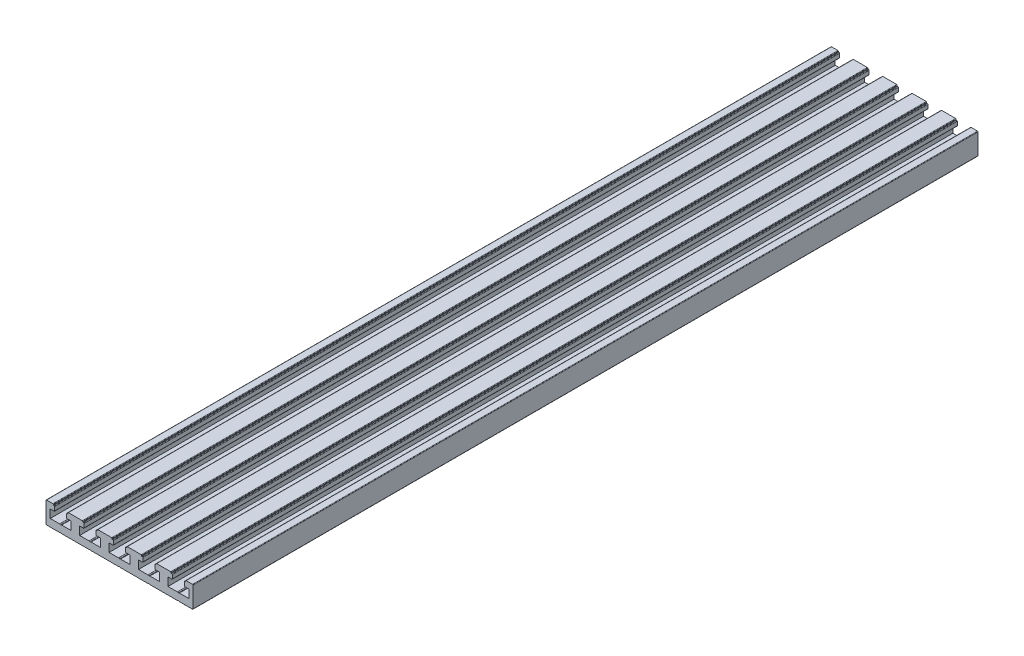
from build123d import *

# Parameters (mm, degrees)
RAWPART_DEPTH                                   = 400
CSK_FOR_M3_FLAT_HEAD_MACHINE_SCREW1_D           = 3.2
CSK_FOR_M3_FLAT_HEAD_MACHINE_SCREW1_CSINK_D     = 6
CSK_FOR_M3_FLAT_HEAD_MACHINE_SCREW1_CSINK_ANGLE = 90
M4X0_7_TAPPED_HOLE1_D                           = 3.3


with BuildPart() as part:
    # Sketch1 → RawPart (new body)
    with BuildSketch(Plane(origin=(0, 0, 0), x_dir=(-1, 0, 0), z_dir=(0, 0, -1))):
        with BuildLine():
            Line((-37.45, 8.85), (-37.45, -1.65))
            ThreePointArc((-37.45, -1.65), (-37.376776695, -1.826776695), (-37.2, -1.9))
            Line((-37.2, -1.9), (-30.543629459, -1.9))
            ThreePointArc((-30.543629459, -1.9), (-30.500649598, -1.896277753), (-30.458949592, -1.885221853))
            Line((-30.458949592, -1.885221853), (-30, -1.72))
            Line((-30, -1.72), (-29.541050408, -1.885221853))
            ThreePointArc((-29.541050408, -1.885221853), (-29.499350402, -1.896277753), (-29.456370541, -1.9))
            Line((-29.456370541, -1.9), (-15.543629459, -1.9))
            ThreePointArc((-15.543629459, -1.9), (-15.500649598, -1.896277753), (-15.458949592, -1.885221853))
            Line((-15.458949592, -1.885221853), (-15, -1.72))
            Line((-15, -1.72), (-14.541050408, -1.885221853))
            ThreePointArc((-14.541050408, -1.885221853), (-14.499350402, -1.896277753), (-14.456370541, -1.9))
            Line((-14.456370541, -1.9), (-0.543629459, -1.9))
            ThreePointArc((-0.543629459, -1.9), (-0.500649598, -1.896277753), (-0.458949592, -1.885221853))
            Line((-0.458949592, -1.885221853), (0, -1.72))
            Line((0, -1.72), (0.458949592, -1.885221853))
            ThreePointArc((0.458949592, -1.885221853), (0.500649598, -1.896277753), (0.543629459, -1.9))
            Line((0.543629459, -1.9), (14.456370541, -1.9))
            ThreePointArc((14.456370541, -1.9), (14.499350402, -1.896277753), (14.541050408, -1.885221853))
            Line((14.541050408, -1.885221853), (15, -1.72))
            Line((15, -1.72), (15.458949592, -1.885221853))
            ThreePointArc((15.458949592, -1.885221853), (15.500649598, -1.896277753), (15.543629459, -1.9))
            Line((15.543629459, -1.9), (29.456370541, -1.9))
            ThreePointArc((29.456370541, -1.9), (29.499350402, -1.896277753), (29.541050408, -1.885221853))
            Line((29.541050408, -1.885221853), (30, -1.72))
            Line((30, -1.72), (30.458949592, -1.885221853))
            ThreePointArc((30.458949592, -1.885221853), (30.500649598, -1.896277753), (30.543629459, -1.9))
            Line((30.543629459, -1.9), (37.2, -1.9))
            ThreePointArc((37.2, -1.9), (37.376776695, -1.826776695), (37.45, -1.65))
            Line((37.45, -1.65), (37.45, 8.85))
            ThreePointArc((37.45, 8.85), (37.376776695, 9.026776695), (37.2, 9.1))
            Line((37.2, 9.1), (33.95, 9.1))
            ThreePointArc((33.95, 9.1), (33.773223305, 9.026776695), (33.7, 8.85))
            Line((33.7, 8.85), (33.7, 8.5))
            Line((33.7, 8.5), (33.32, 8.5))
            ThreePointArc((33.32, 8.5), (33.143223305, 8.426776695), (33.07, 8.25))
            Line((33.07, 8.25), (33.07, 6.35))
            ThreePointArc((33.07, 6.35), (33.143223305, 6.173223305), (33.32, 6.1))
            Line((33.32, 6.1), (35.3, 6.1))
            Line((35.3, 6.1), (35.3, 1.9))
            Line((35.3, 1.9), (30.543629459, 1.9))
            ThreePointArc((30.543629459, 1.9), (30.500649598, 1.896277753), (30.458949592, 1.885221853))
            Line((30.458949592, 1.885221853), (30, 1.72))
            Line((30, 1.72), (29.541050408, 1.885221853))
            ThreePointArc((29.541050408, 1.885221853), (29.499350402, 1.896277753), (29.456370541, 1.9))
            Line((29.456370541, 1.9), (24.7, 1.9))
            Line((24.7, 1.9), (24.7, 6.1))
            Line((24.7, 6.1), (26.68, 6.1))
            ThreePointArc((26.68, 6.1), (26.856776695, 6.173223305), (26.93, 6.35))
            Line((26.93, 6.35), (26.93, 8.25))
            ThreePointArc((26.93, 8.25), (26.856776695, 8.426776695), (26.68, 8.5))
            Line((26.68, 8.5), (26.3, 8.5))
            Line((26.3, 8.5), (26.3, 8.85))
            ThreePointArc((26.3, 8.85), (26.226776695, 9.026776695), (26.05, 9.1))
            Line((26.05, 9.1), (18.95, 9.1))
            ThreePointArc((18.95, 9.1), (18.773223305, 9.026776695), (18.7, 8.85))
            Line((18.7, 8.85), (18.7, 8.5))
            Line((18.7, 8.5), (18.32, 8.5))
            ThreePointArc((18.32, 8.5), (18.143223305, 8.426776695), (18.07, 8.25))
            Line((18.07, 8.25), (18.07, 6.35))
            ThreePointArc((18.07, 6.35), (18.143223305, 6.173223305), (18.32, 6.1))
            Line((18.32, 6.1), (20.3, 6.1))
            Line((20.3, 6.1), (20.3, 1.9))
            Line((20.3, 1.9), (15.543629459, 1.9))
            ThreePointArc((15.543629459, 1.9), (15.500649598, 1.896277753), (15.458949592, 1.885221853))
            Line((15.458949592, 1.885221853), (15, 1.72))
            Line((15, 1.72), (14.541050408, 1.885221853))
            ThreePointArc((14.541050408, 1.885221853), (14.499350402, 1.896277753), (14.456370541, 1.9))
            Line((14.456370541, 1.9), (9.7, 1.9))
            Line((9.7, 1.9), (9.7, 6.1))
            Line((9.7, 6.1), (11.68, 6.1))
            ThreePointArc((11.68, 6.1), (11.856776695, 6.173223305), (11.93, 6.35))
            Line((11.93, 6.35), (11.93, 8.25))
            ThreePointArc((11.93, 8.25), (11.856776695, 8.426776695), (11.68, 8.5))
            Line((11.68, 8.5), (11.3, 8.5))
            Line((11.3, 8.5), (11.3, 8.85))
            ThreePointArc((11.3, 8.85), (11.226776695, 9.026776695), (11.05, 9.1))
            Line((11.05, 9.1), (3.95, 9.1))
            ThreePointArc((3.95, 9.1), (3.773223305, 9.026776695), (3.7, 8.85))
            Line((3.7, 8.85), (3.7, 8.5))
            Line((3.7, 8.5), (3.32, 8.5))
            ThreePointArc((3.32, 8.5), (3.143223305, 8.426776695), (3.07, 8.25))
            Line((3.07, 8.25), (3.07, 6.35))
            ThreePointArc((3.07, 6.35), (3.143223305, 6.173223305), (3.32, 6.1))
            Line((3.32, 6.1), (5.3, 6.1))
            Line((5.3, 6.1), (5.3, 1.9))
            Line((5.3, 1.9), (0.543629459, 1.9))
            ThreePointArc((0.543629459, 1.9), (0.500649598, 1.896277753), (0.458949592, 1.885221853))
            Line((0.458949592, 1.885221853), (0, 1.72))
            Line((0, 1.72), (-0.458949592, 1.885221853))
            ThreePointArc((-0.458949592, 1.885221853), (-0.500649598, 1.896277753), (-0.543629459, 1.9))
            Line((-0.543629459, 1.9), (-5.3, 1.9))
            Line((-5.3, 1.9), (-5.3, 6.1))
            Line((-5.3, 6.1), (-3.32, 6.1))
            ThreePointArc((-3.32, 6.1), (-3.143223305, 6.173223305), (-3.07, 6.35))
            Line((-3.07, 6.35), (-3.07, 8.25))
            ThreePointArc((-3.07, 8.25), (-3.143223305, 8.426776695), (-3.32, 8.5))
            Line((-3.32, 8.5), (-3.7, 8.5))
            Line((-3.7, 8.5), (-3.7, 8.85))
            ThreePointArc((-3.7, 8.85), (-3.773223305, 9.026776695), (-3.95, 9.1))
            Line((-3.95, 9.1), (-11.05, 9.1))
            ThreePointArc((-11.05, 9.1), (-11.226776695, 9.026776695), (-11.3, 8.85))
            Line((-11.3, 8.85), (-11.3, 8.5))
            Line((-11.3, 8.5), (-11.68, 8.5))
            ThreePointArc((-11.68, 8.5), (-11.856776695, 8.426776695), (-11.93, 8.25))
            Line((-11.93, 8.25), (-11.93, 6.35))
            ThreePointArc((-11.93, 6.35), (-11.856776695, 6.173223305), (-11.68, 6.1))
            Line((-11.68, 6.1), (-9.7, 6.1))
            Line((-9.7, 6.1), (-9.7, 1.9))
            Line((-9.7, 1.9), (-14.456370541, 1.9))
            ThreePointArc((-14.456370541, 1.9), (-14.499350402, 1.896277753), (-14.541050408, 1.885221853))
            Line((-14.541050408, 1.885221853), (-15, 1.72))
            Line((-15, 1.72), (-15.458949592, 1.885221853))
            ThreePointArc((-15.458949592, 1.885221853), (-15.500649598, 1.896277753), (-15.543629459, 1.9))
            Line((-15.543629459, 1.9), (-20.3, 1.9))
            Line((-20.3, 1.9), (-20.3, 6.1))
            Line((-20.3, 6.1), (-18.32, 6.1))
            ThreePointArc((-18.32, 6.1), (-18.143223305, 6.173223305), (-18.07, 6.35))
            Line((-18.07, 6.35), (-18.07, 8.25))
            ThreePointArc((-18.07, 8.25), (-18.143223305, 8.426776695), (-18.32, 8.5))
            Line((-18.32, 8.5), (-18.7, 8.5))
            Line((-18.7, 8.5), (-18.7, 8.85))
            ThreePointArc((-18.7, 8.85), (-18.773223305, 9.026776695), (-18.95, 9.1))
            Line((-18.95, 9.1), (-26.05, 9.1))
            ThreePointArc((-26.05, 9.1), (-26.226776695, 9.026776695), (-26.3, 8.85))
            Line((-26.3, 8.85), (-26.3, 8.5))
            Line((-26.3, 8.5), (-26.68, 8.5))
            ThreePointArc((-26.68, 8.5), (-26.856776695, 8.426776695), (-26.93, 8.25))
            Line((-26.93, 8.25), (-26.93, 6.35))
            ThreePointArc((-26.93, 6.35), (-26.856776695, 6.173223305), (-26.68, 6.1))
            Line((-26.68, 6.1), (-24.7, 6.1))
            Line((-24.7, 6.1), (-24.7, 1.9))
            Line((-24.7, 1.9), (-29.456370541, 1.9))
            ThreePointArc((-29.456370541, 1.9), (-29.499350402, 1.896277753), (-29.541050408, 1.885221853))
            Line((-29.541050408, 1.885221853), (-30, 1.72))
            Line((-30, 1.72), (-30.458949592, 1.885221853))
            ThreePointArc((-30.458949592, 1.885221853), (-30.500649598, 1.896277753), (-30.543629459, 1.9))
            Line((-30.543629459, 1.9), (-35.3, 1.9))
            Line((-35.3, 1.9), (-35.3, 6.1))
            Line((-35.3, 6.1), (-33.32, 6.1))
            ThreePointArc((-33.32, 6.1), (-33.143223305, 6.173223305), (-33.07, 6.35))
            Line((-33.07, 6.35), (-33.07, 8.25))
            ThreePointArc((-33.07, 8.25), (-33.143223305, 8.426776695), (-33.32, 8.5))
            Line((-33.32, 8.5), (-33.7, 8.5))
            Line((-33.7, 8.5), (-33.7, 8.85))
            ThreePointArc((-33.7, 8.85), (-33.773223305, 9.026776695), (-33.95, 9.1))
            Line((-33.95, 9.1), (-37.2, 9.1))
            ThreePointArc((-37.2, 9.1), (-37.376776695, 9.026776695), (-37.45, 8.85))
        make_face()
    extrude(amount=-RAWPART_DEPTH)

    # CSK for M3 Flat Head Machine Screw1 (through all)
    with Locations(Plane(origin=(-30, 1.9, 65), x_dir=(0, 0, 1), z_dir=(0, 1, 0))):
        with Locations((0, 0), (0, 60), (264.999950909, 60), (264.999950909, 0)):
            CounterSinkHole(CSK_FOR_M3_FLAT_HEAD_MACHINE_SCREW1_D / 2, CSK_FOR_M3_FLAT_HEAD_MACHINE_SCREW1_CSINK_D / 2, counter_sink_angle=CSK_FOR_M3_FLAT_HEAD_MACHINE_SCREW1_CSINK_ANGLE)

    # M4x0.7 Tapped Hole1 (through all)
    with Locations(Plane(origin=(0, 1.9, 0), x_dir=(1, 0, 0), z_dir=(0, 1, 0))):
        with Locations((15, -30), (15, -371)):
            Hole(M4X0_7_TAPPED_HOLE1_D / 2)


solid = part.part
